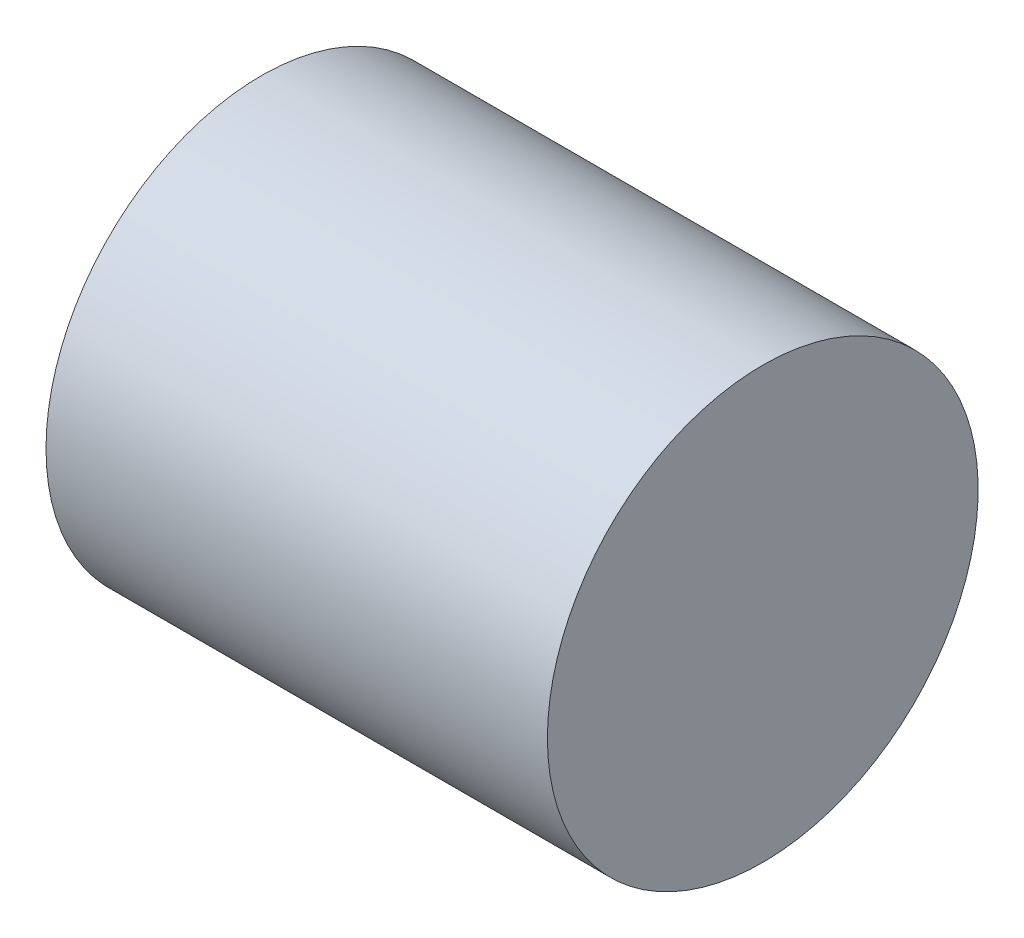
from build123d import *

# Parameters (mm, degrees)
CAP_T6_SKETCH_W   = 22
CAP_T6_SKETCH_H   = 9.45
SOCKET_1_SKETCH_W = 17.8
SOCKET_1_SKETCH_H = 4.7625


with BuildPart() as part:
    # Cap_T6 Sketch → Cap_T6 (revolve)
    with BuildSketch(Plane.XY):
        with Locations((11, 4.725)):
            Rectangle(CAP_T6_SKETCH_W, CAP_T6_SKETCH_H)
    revolve(axis=Axis((-1000, 0, 0), (1, 0, 0)))

    # Socket 1 Sketch → Socket 1 (revolve, cut)
    with BuildSketch(Plane.XY):
        with Locations((7.9, 2.38125)):
            Rectangle(SOCKET_1_SKETCH_W, SOCKET_1_SKETCH_H)
    revolve(axis=Axis((-1000, 0, 0), (1, 0, 0)), mode=Mode.SUBTRACT)


solid = part.part
